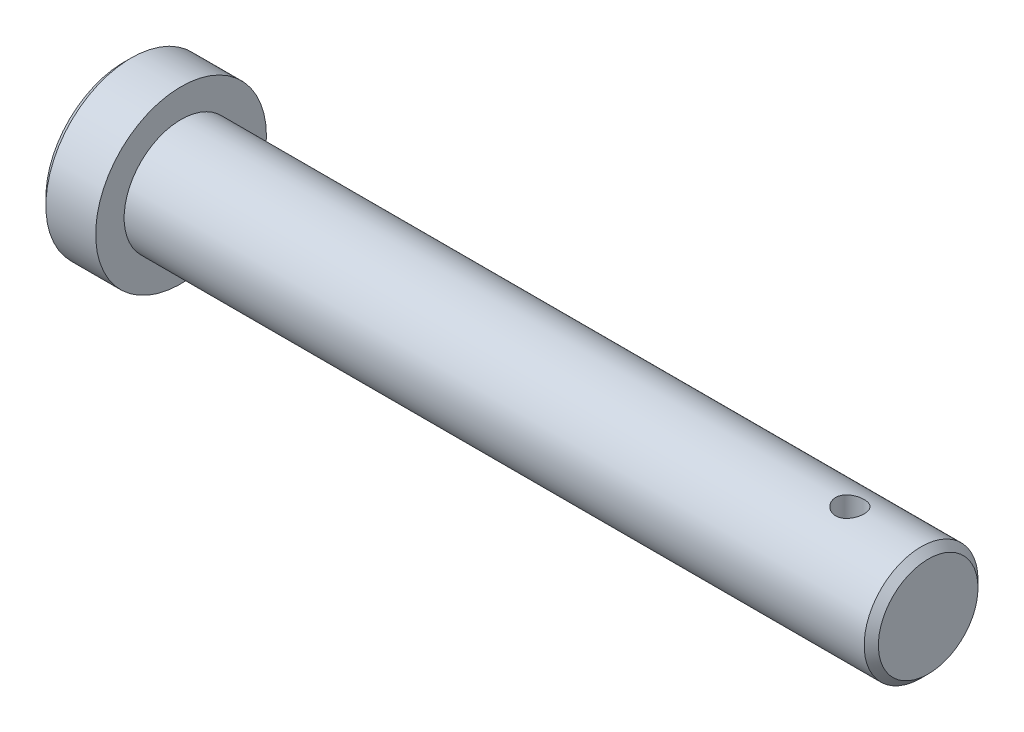
from build123d import *

# Parameters (mm, degrees)
SKETCH2_R           = 12
BOSS_EXTRUDE1_DEPTH = 8
CHAMFER1_SIZE       = 1
SKETCH3_R           = 8
BOSS_EXTRUDE2_DEPTH = 105
CHAMFER2_SIZE       = 1
SKETCH4_R           = 2
CUT_EXTRUDE1_DEPTH  = 52.5


with BuildPart() as part:
    # Sketch2 → Boss-Extrude1 (new body)
    with BuildSketch(Plane(origin=(0, 0, 0), x_dir=(0, 0, -1), z_dir=(1, 0, 0))):
        Circle(SKETCH2_R)
    extrude(amount=BOSS_EXTRUDE1_DEPTH)

    # Chamfer1
    chamfer1_edges = [part.edges().sort_by_distance(p)[0] for p in [
        (0, 0, 12),
    ]]
    chamfer(chamfer1_edges, length=CHAMFER1_SIZE)

    # Sketch3 → Boss-Extrude2 (add)
    with BuildSketch(Plane(origin=(8, 0, 0), x_dir=(0, 0, -1), z_dir=(1, 0, 0))):
        Circle(SKETCH3_R)
    extrude(amount=BOSS_EXTRUDE2_DEPTH)

    # Chamfer2
    chamfer2_edges = [part.edges().sort_by_distance(p)[0] for p in [
        (113, 0, 8),
    ]]
    chamfer(chamfer2_edges, length=CHAMFER2_SIZE)

    # Sketch4 → Cut-Extrude1 (cut, symmetric)
    with BuildSketch(Plane(origin=(0, 0, 0), x_dir=(1, 0, 0), z_dir=(0, 1, 0))):
        with Locations(Location((102, 0, 0), (0, 0, 270))):
            Circle(SKETCH4_R)
    extrude(amount=CUT_EXTRUDE1_DEPTH, both=True, mode=Mode.SUBTRACT)


solid = part.part
